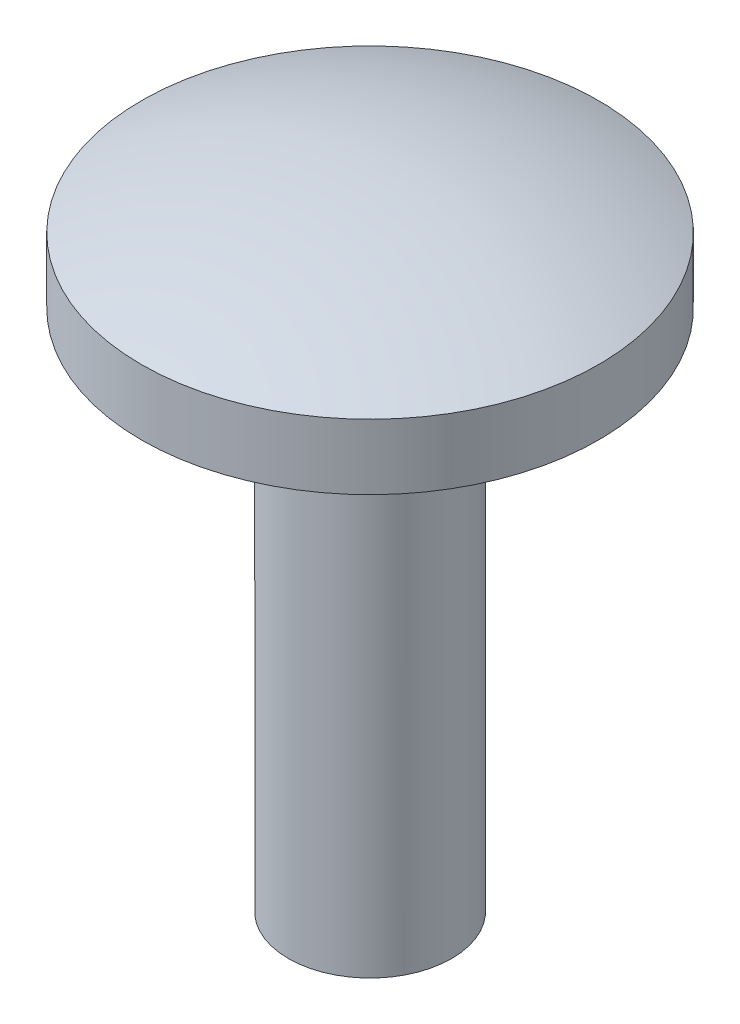
from build123d import *

# Parameters (mm, degrees)
SKETCH1_R           = 3.5
BOSS_EXTRUDE1_DEPTH = 1
DOME1_FACE_RADIUS   = 3.5
DOME1_HEIGHT        = 0.75
SKETCH2_R           = 1.25
BOSS_EXTRUDE2_DEPTH = 8


with BuildPart() as part:
    # Sketch1 → Boss-Extrude1 (new body)
    with BuildSketch(Plane(origin=(0, 0, 0), x_dir=(1, 0, 0), z_dir=(0, 1, 0))):
        with Locations(Location((0, 0, 0), (0, 0, 270))):
            Circle(SKETCH1_R)
    extrude(amount=BOSS_EXTRUDE1_DEPTH)

    # Dome1: a dome of height H over a round flat face of radius A is a cap of a sphere of radius (A * A + H * H) / (2 * H)
    dome1_r = (DOME1_FACE_RADIUS * DOME1_FACE_RADIUS + DOME1_HEIGHT * DOME1_HEIGHT) / (2 * DOME1_HEIGHT)
    dome1_base = Plane((0, 1, 0), z_dir=(0, 1, 0))
    with Locations(dome1_base.offset(DOME1_HEIGHT - dome1_r)):
        dome1_ball = Sphere(dome1_r, mode=Mode.PRIVATE)
    add(split(dome1_ball, bisect_by=dome1_base, keep=Keep.TOP, mode=Mode.PRIVATE))

    # Sketch2 → Boss-Extrude2 (add)
    with BuildSketch(Plane.XZ):
        with Locations(Location((0, 0, 0), (0, 0, 90))):
            Circle(SKETCH2_R)
    extrude(amount=BOSS_EXTRUDE2_DEPTH)


solid = part.part
